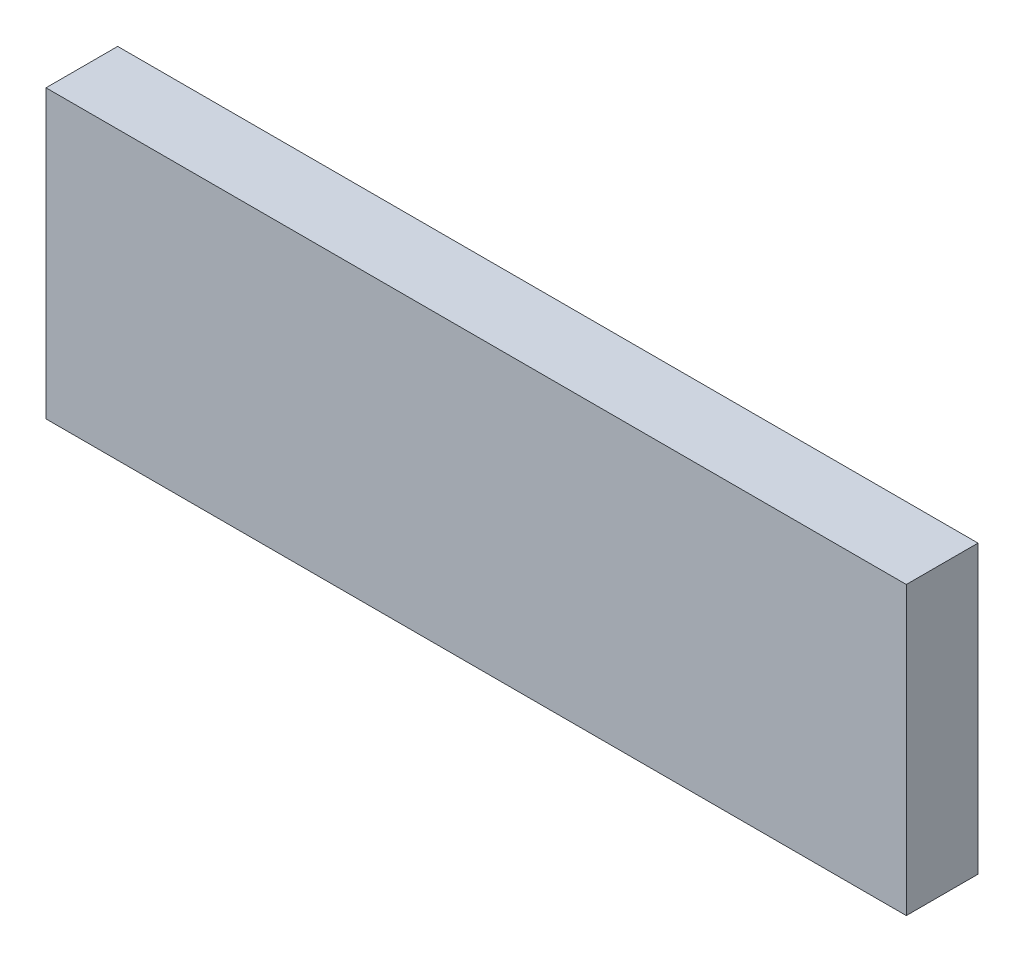
from build123d import *

# Parameters (mm, degrees)
SKETCH1_W           = 152.4
SKETCH1_H           = 50.8
BOSS_EXTRUDE1_DEPTH = 12.7


with BuildPart() as part:
    # Sketch1 → Boss-Extrude1 (new body)
    with BuildSketch(Plane.XY):
        Rectangle(SKETCH1_W, SKETCH1_H)
    extrude(amount=BOSS_EXTRUDE1_DEPTH)


solid = part.part
